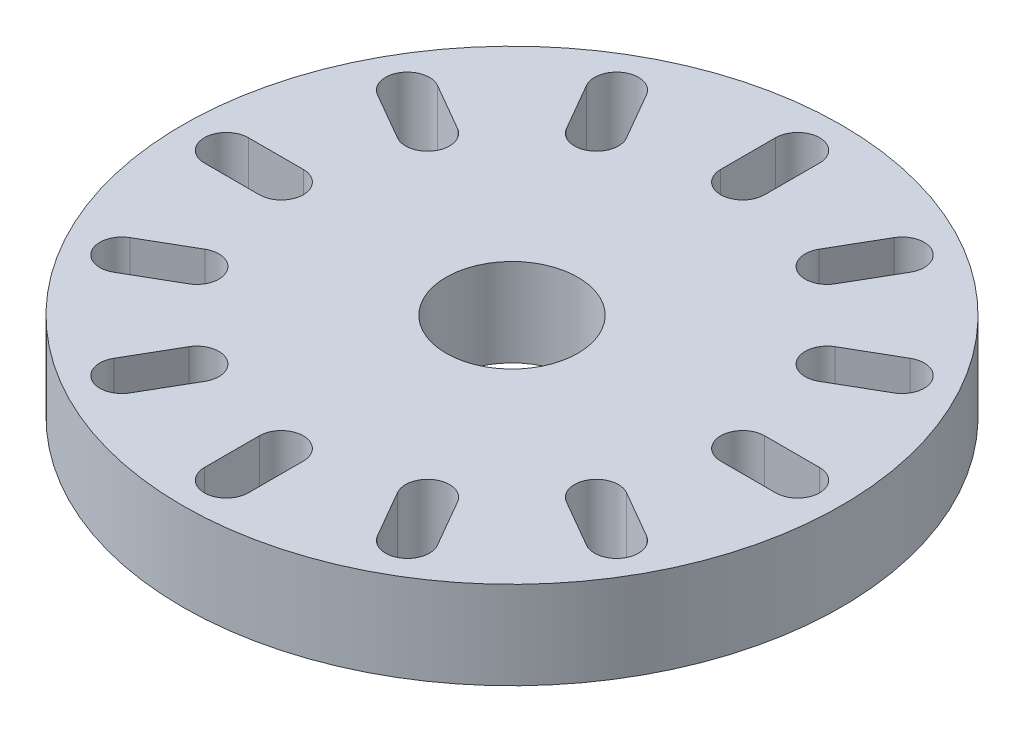
from build123d import *

# Parameters (mm, degrees)
SKETCH_1_R               = 30
SKETCH_1_R_2             = 6
EXTRUDE_1_DEPTH          = 8
CUT_EXTRUDE_1_DEPTH      = 61
PATTERN_CIRCULAR_1_COUNT = 12


with BuildPart() as part:
    # 草图1 → 凸台-拉伸1 (new body)
    with BuildSketch(Plane(origin=(0, 0, 0), x_dir=(1, 0, 0), z_dir=(0, 1, 0))):
        Circle(SKETCH_1_R)
        Circle(SKETCH_1_R_2, mode=Mode.SUBTRACT)
    extrude(amount=EXTRUDE_1_DEPTH)

    # 草图2 → 切除-拉伸1 (cut, symmetric)
    with BuildSketch(Plane(origin=(0, 0, 0), x_dir=(1, 0, 0), z_dir=(0, 1, 0))):
        with BuildLine():
            Line((21, 2), (26, 2))
            ThreePointArc((26, 2), (28, 0), (26, -2))
            Line((26, -2), (21, -2))
            ThreePointArc((21, -2), (19, 0), (21, 2))
        make_face()
    cut_extrude_1 = extrude(amount=CUT_EXTRUDE_1_DEPTH, both=True, mode=Mode.SUBTRACT)

    # 阵列(圆周)1: 切除-拉伸1 ×12 about axis
    pattern_circular_1_axis = Axis((0, -0.4, 0), (0, 1, 0))
    for i in range(1, PATTERN_CIRCULAR_1_COUNT):
        add(cut_extrude_1.rotate(pattern_circular_1_axis, i * 360 / PATTERN_CIRCULAR_1_COUNT), mode=Mode.SUBTRACT)


solid = part.part
